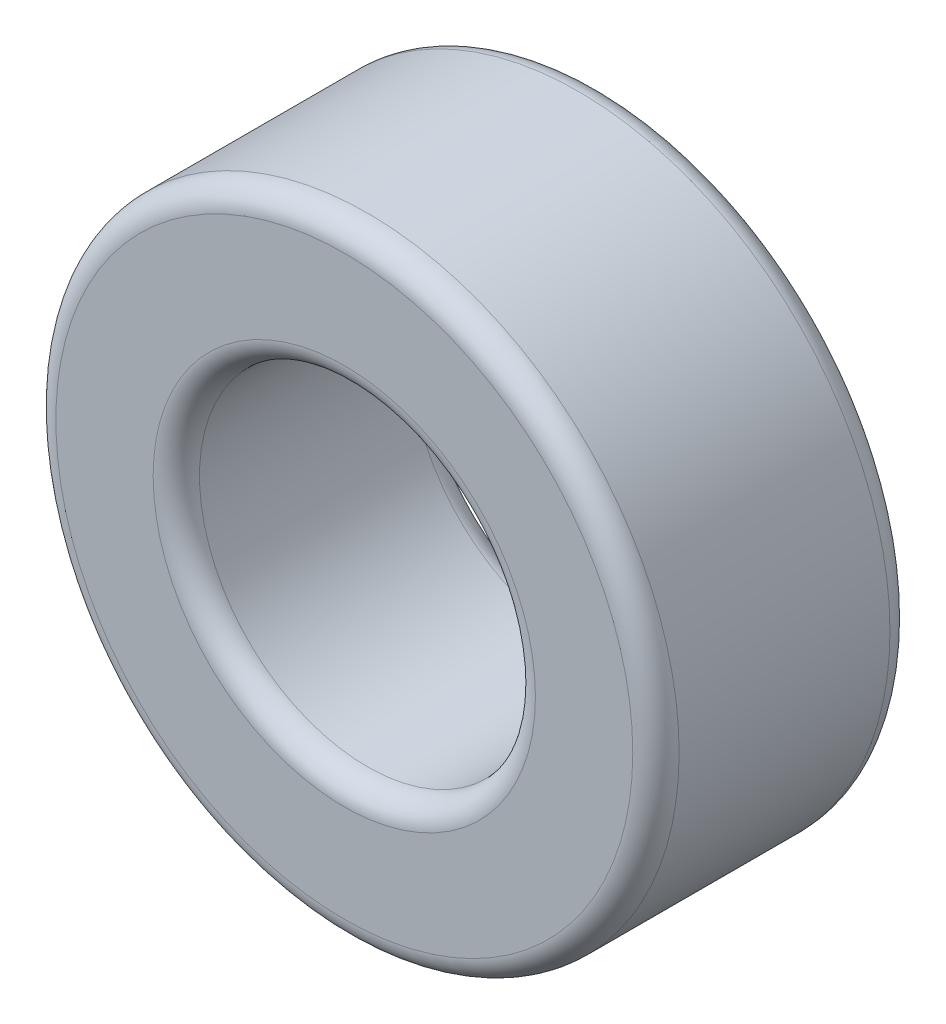
from build123d import *

# Parameters (mm, degrees)
ESBO_O1_R                = 13.45
ESBO_O1_R_2              = 7.25
RESSALTO_EXTRUS_O1_DEPTH = 11.1
FILETE1_R                = 1


with BuildPart() as part:
    # Esboço1 → Ressalto-extrusão1 (new body)
    with BuildSketch(Plane.XY):
        Circle(ESBO_O1_R)
        Circle(ESBO_O1_R_2, mode=Mode.SUBTRACT)
    extrude(amount=RESSALTO_EXTRUS_O1_DEPTH)

    # Filete1
    filete1_edges = [part.edges().sort_by_distance(p)[0] for p in [
        (-13.45, 0, 0),
        (-13.45, 0, 11.1),
        (-7.25, 0, 0),
        (-7.25, 0, 11.1),
    ]]
    fillet(filete1_edges, radius=FILETE1_R)


solid = part.part
